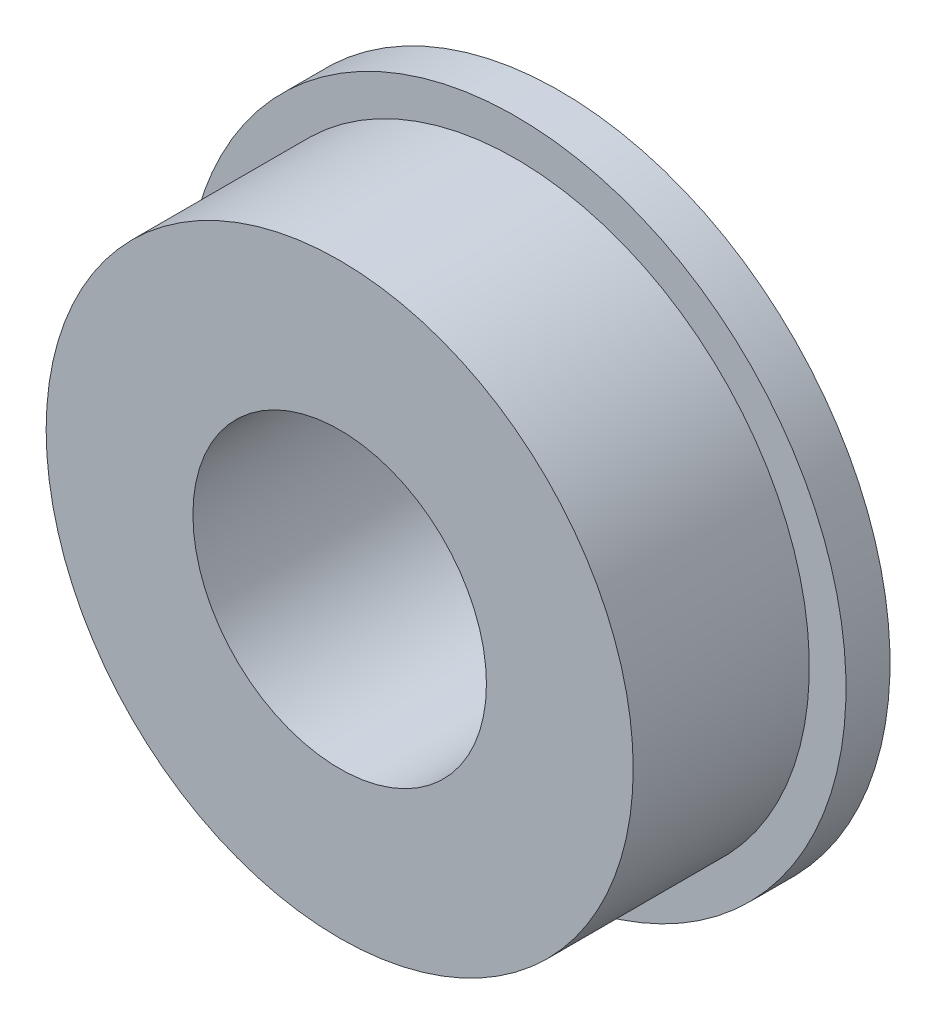
from build123d import *

# Parameters (mm, degrees)
SKETCH1_R           = 4
SKETCH1_R_2         = 2
BOSS_EXTRUDE1_DEPTH = 3
SKETCH2_R           = 4.5
SKETCH2_R_2         = 2
BOSS_EXTRUDE2_DEPTH = 0.6


with BuildPart() as part:
    # Sketch1 → Boss-Extrude1 (new body)
    with BuildSketch(Plane.XY):
        Circle(SKETCH1_R)
        Circle(SKETCH1_R_2, mode=Mode.SUBTRACT)
    extrude(amount=BOSS_EXTRUDE1_DEPTH)

    # Sketch2 → Boss-Extrude2 (add)
    with BuildSketch(Plane(origin=(0, 0, 0), x_dir=(-1, 0, 0), z_dir=(0, 0, -1))):
        Circle(SKETCH2_R)
        with Locations(Location((0, 0, 0), (0, 0, 180))):
            Circle(SKETCH2_R_2, mode=Mode.SUBTRACT)
    extrude(amount=-BOSS_EXTRUDE2_DEPTH)


solid = part.part
